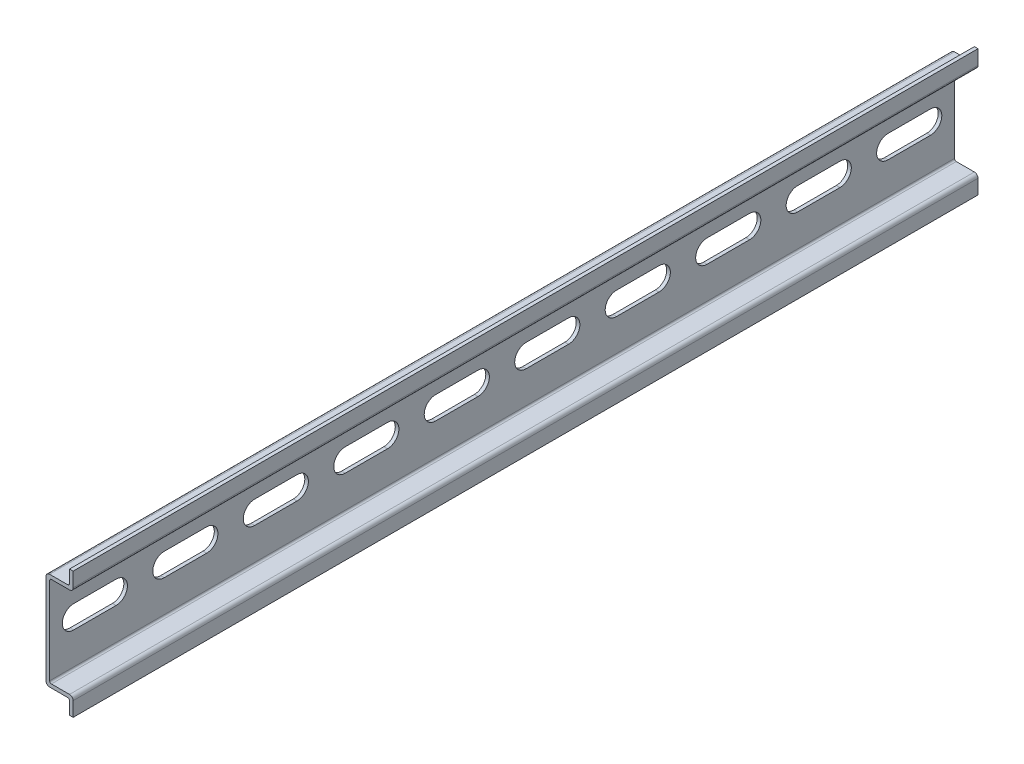
from build123d import *

# Parameters (mm, degrees)
BOSS_EXTRUDE1_DEPTH = 125
CUT_EXTRUDE1_DEPTH  = 7.5
LPATTERN1_COUNT     = 10
LPATTERN1_PITCH     = 25


with BuildPart() as part:
    # Sketch1 → Boss-Extrude1 (new, symmetric)
    with BuildSketch(Plane.XY):
        with BuildLine():
            Line((7.5, 17.5), (6.5, 17.5))
            Line((6.5, 17.5), (6.5, 14))
            ThreePointArc((6.5, 14), (6.353553391, 13.646446609), (6, 13.5))
            Line((6, 13.5), (1, 13.5))
            ThreePointArc((1, 13.5), (0.292893219, 13.207106781), (0, 12.5))
            Line((0, 12.5), (0, -12.5))
            ThreePointArc((0, -12.5), (0.292893219, -13.207106781), (1, -13.5))
            Line((1, -13.5), (6, -13.5))
            ThreePointArc((6, -13.5), (6.353553391, -13.646446609), (6.5, -14))
            Line((6.5, -14), (6.5, -17.5))
            Line((6.5, -17.5), (7.5, -17.5))
            Line((7.5, -17.5), (7.5, -13.5))
            ThreePointArc((7.5, -13.5), (7.207106781, -12.792893219), (6.5, -12.5))
            Line((6.5, -12.5), (1.5, -12.5))
            ThreePointArc((1.5, -12.5), (1.146446609, -12.353553391), (1, -12))
            Line((1, -12), (1, 12))
            ThreePointArc((1, 12), (1.146446609, 12.353553391), (1.5, 12.5))
            Line((1.5, 12.5), (6.5, 12.5))
            ThreePointArc((6.5, 12.5), (7.207106781, 12.792893219), (7.5, 13.5))
            Line((7.5, 13.5), (7.5, 17.5))
        make_face()
    extrude(amount=BOSS_EXTRUDE1_DEPTH, both=True)

    # Sketch2 → Cut-Extrude1 (cut)
    with BuildSketch(Plane(origin=(0, 0, 0), x_dir=(0, 0, -1), z_dir=(1, 0, 0))):
        with BuildLine():
            Line((-118.35, 3.15), (-106.65, 3.15))
            ThreePointArc((-106.65, 3.15), (-103.5, 0), (-106.65, -3.15))
            Line((-106.65, -3.15), (-118.35, -3.15))
            ThreePointArc((-118.35, -3.15), (-121.5, 0), (-118.35, 3.15))
        make_face()
    cut_extrude1 = extrude(amount=CUT_EXTRUDE1_DEPTH, mode=Mode.SUBTRACT)

    # LPattern1: Cut-Extrude1 ×10
    with Locations(*[(0, 0, -i * LPATTERN1_PITCH) for i in range(1, LPATTERN1_COUNT)]):
        add(cut_extrude1, mode=Mode.SUBTRACT)


solid = part.part
